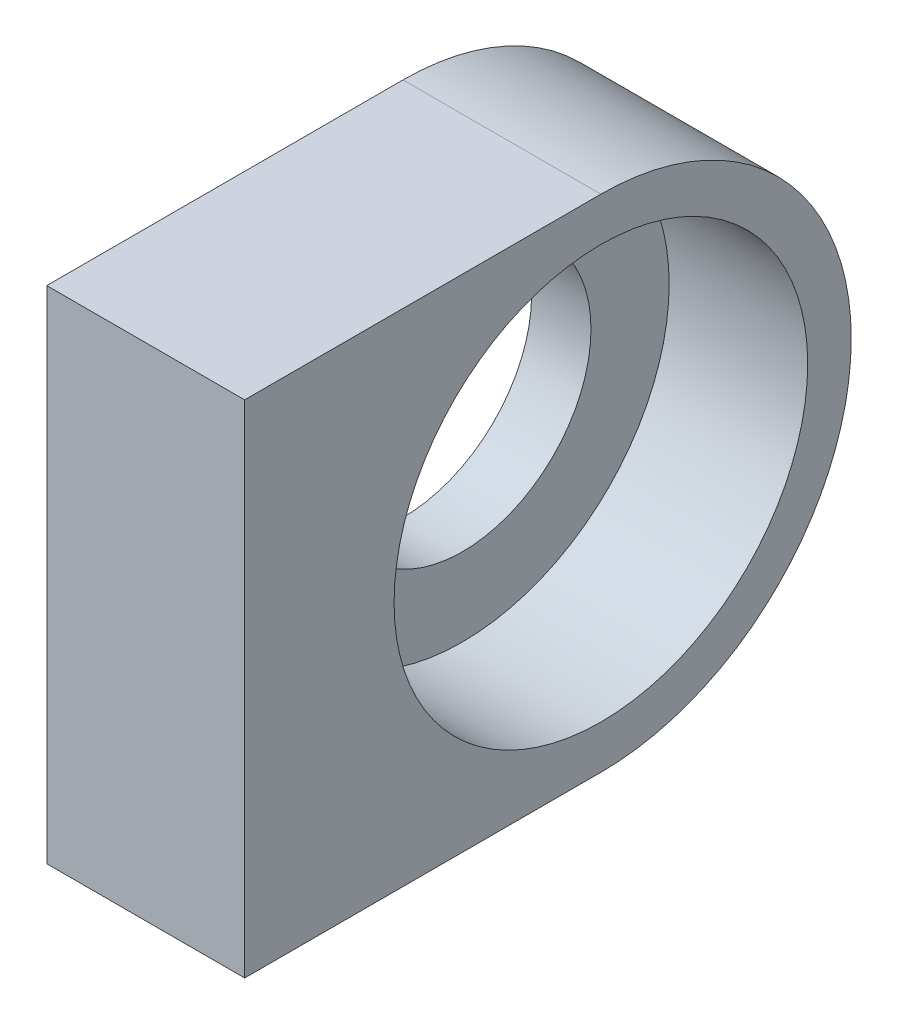
from build123d import *

# Parameters (mm, degrees)
BOSS_EXTRUDE1_DEPTH = 10
SKETCH2_R           = 10.45
CUT_EXTRUDE1_DEPTH  = 7
SKETCH3_R           = 6.5
CUT_EXTRUDE2_DEPTH  = 24.087280048


with BuildPart() as part:
    # Sketch1 → Boss-Extrude1 (new body)
    with BuildSketch(Plane.YZ):
        with BuildLine():
            Line((-12.65, 0), (-12.65, 18))
            Line((-12.65, 18), (12.65, 18))
            Line((12.65, 18), (12.65, 0))
            ThreePointArc((12.65, 0), (0, -12.65), (-12.65, 0))
        make_face()
    extrude(amount=BOSS_EXTRUDE1_DEPTH)

    # Sketch2 → Cut-Extrude1 (cut)
    with BuildSketch(Plane.YZ.offset(10)):
        with Locations(Location((0, 0, 0), (0, 0, 270))):
            Circle(SKETCH2_R)
    extrude(amount=-CUT_EXTRUDE1_DEPTH, mode=Mode.SUBTRACT)

    # Sketch3 → Cut-Extrude2 (cut, through all)
    with BuildSketch(Plane.YZ.offset(3)):
        with Locations(Location((0, 0, 0), (0, 0, 270))):
            Circle(SKETCH3_R)
    extrude(amount=-CUT_EXTRUDE2_DEPTH, mode=Mode.SUBTRACT)


solid = part.part
